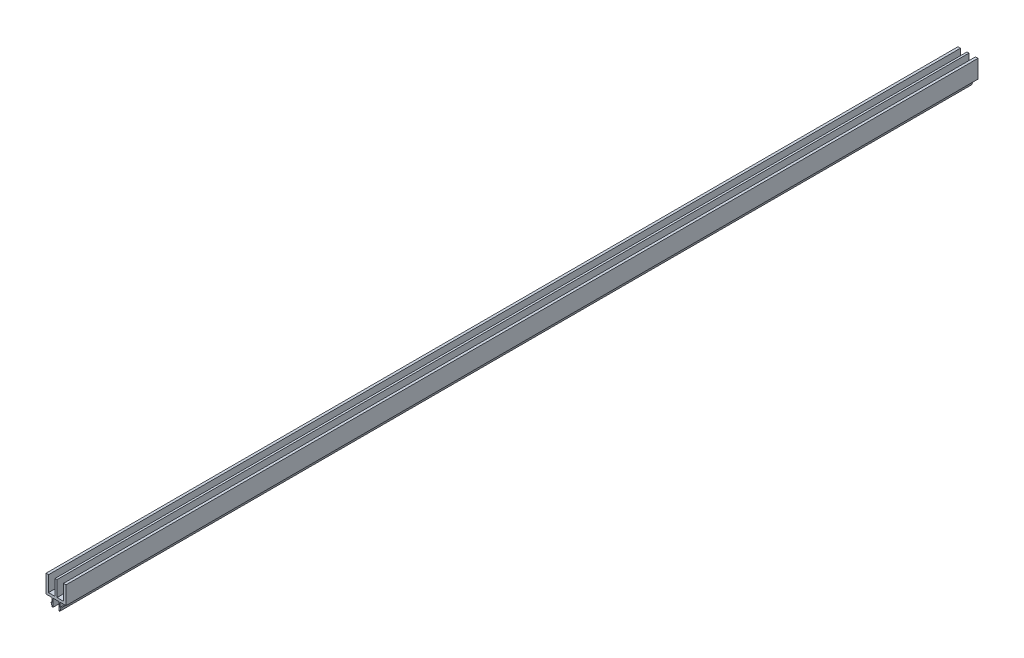
from build123d import *

# Parameters (mm, degrees)
BOSS_EXTRU_1_DEPTH = 910


with BuildPart() as part:
    # Esquisse1 → Boss.-Extru.1 (new body)
    with BuildSketch(Plane.XY.offset(50)):
        Polygon((-1, 2.5), (-7.5, 2.5), (-7.5, 17.999999998), (-10, 17.999999998), (-10, 0), (-4, 0), (-4, -4.5), (-5, -4.5), (-3.75, -8), (-3, -8), (-3, 0), (3, 0), (3, -8), (3.75, -8), (5, -4.5), (4, -4.5), (4, 0), (10, 0), (10, 17.999999998), (7.5, 17.999999998), (7.5, 2.5), (1, 2.5), (1, 17.999999998), (-1, 17.999999998), align=None)
    extrude(amount=-BOSS_EXTRU_1_DEPTH)


solid = part.part
